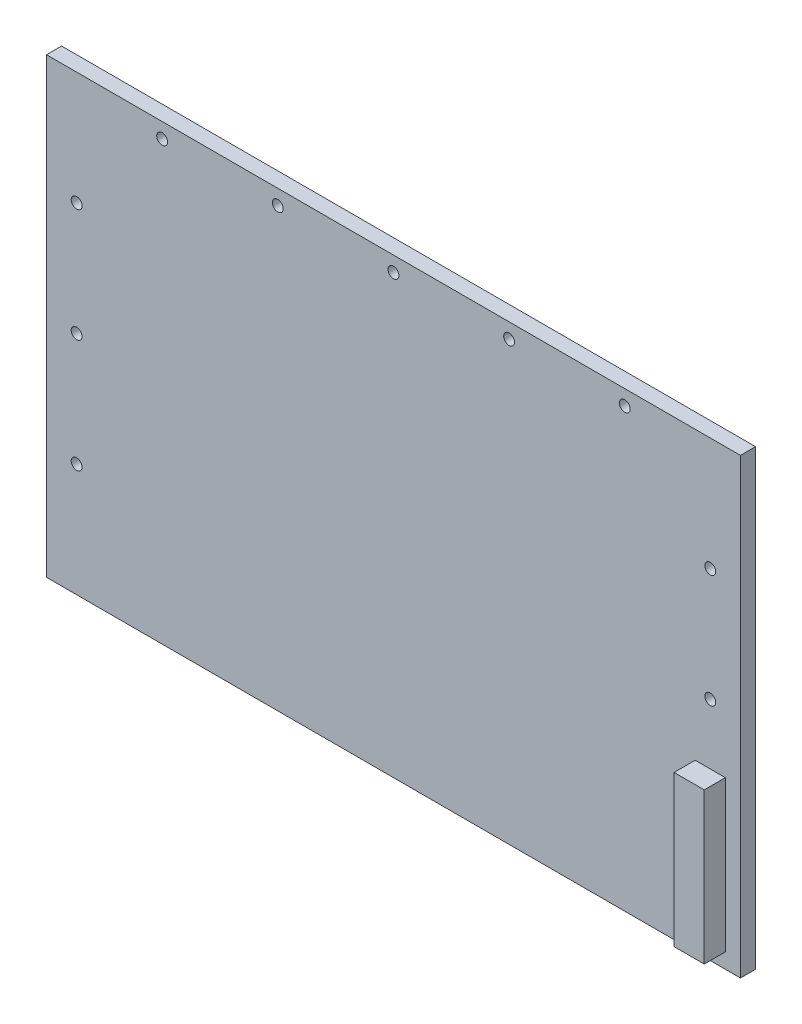
from build123d import *

# Parameters (mm, degrees)
SZKIC1_W                                          = 230
SZKIC1_H                                          = 150
DODANIE_WYCI_GNI_CIE1_DEPTH                       = 5
POG_BIENIE_WALCOWE_POD_M3_RUB_Z_BEM_S_D           = 3.6
POG_BIENIE_WALCOWE_POD_M3_RUB_Z_BEM_S_DEPTH       = 6.7
POG_BIENIE_WALCOWE_POD_M3_RUB_Z_BEM_S_CBORE_D     = 7
POG_BIENIE_WALCOWE_POD_M3_RUB_Z_BEM_S_CBORE_DEPTH = 2.4
POG_BIENIE_WALCOWE_POD_M3_RUB_Z_BEM_S_TIP         = 1.081549114
POG_BIENIE_WALCOWE_POD_M3_RUB_Z_B_2_D             = 3.6
POG_BIENIE_WALCOWE_POD_M3_RUB_Z_B_2_DEPTH         = 6.7
POG_BIENIE_WALCOWE_POD_M3_RUB_Z_B_2_CBORE_D       = 7
POG_BIENIE_WALCOWE_POD_M3_RUB_Z_B_2_CBORE_DEPTH   = 2.4
POG_BIENIE_WALCOWE_POD_M3_RUB_Z_B_2_TIP           = 1.081549114
SZKIC7_W                                          = 10
SZKIC7_H                                          = 50
DODANIE_WYCI_GNI_CIE3_DEPTH                       = 7
OTWORY_USTALAJ_CE_4_0MM1_D                        = 4
OTWORY_USTALAJ_CE_4_0MM1_DEPTH                    = 6.7


with BuildPart() as part:
    # Szkic1 → Dodanie-wyciągnięcie1 (new body)
    with BuildSketch(Plane.XY):
        Rectangle(SZKIC1_W, SZKIC1_H)
    extrude(amount=DODANIE_WYCI_GNI_CIE1_DEPTH)

    # Pog_bienie walcowe pod M3 _rub_ z _bem s
    with Locations(Plane(origin=(0, 0, 0), x_dir=(-1, 0, 0), z_dir=(0, 0, -1))):
        with Locations((105, 37.5), (105, 0), (105, -37.5), (-105, 0), (-105, 37.5)):
            CounterBoreHole(POG_BIENIE_WALCOWE_POD_M3_RUB_Z_BEM_S_D / 2, POG_BIENIE_WALCOWE_POD_M3_RUB_Z_BEM_S_CBORE_D / 2, POG_BIENIE_WALCOWE_POD_M3_RUB_Z_BEM_S_CBORE_DEPTH, depth=POG_BIENIE_WALCOWE_POD_M3_RUB_Z_BEM_S_DEPTH)
            with Locations((0, 0, -(POG_BIENIE_WALCOWE_POD_M3_RUB_Z_BEM_S_DEPTH + POG_BIENIE_WALCOWE_POD_M3_RUB_Z_BEM_S_TIP / 2))):  # 118° drill point
                Cone(0, POG_BIENIE_WALCOWE_POD_M3_RUB_Z_BEM_S_D / 2, POG_BIENIE_WALCOWE_POD_M3_RUB_Z_BEM_S_TIP, mode=Mode.SUBTRACT)

    # Pog_bienie walcowe pod M3 _rub_ z _b 2
    with Locations(Plane(origin=(0, 0, 0), x_dir=(-1, 0, 0), z_dir=(0, 0, -1))):
        with Locations((-76.666666667, 70), (-38.333333337, 70), (-7e-09, 70), (38.333333323, 70), (76.666666653, 70)):
            CounterBoreHole(POG_BIENIE_WALCOWE_POD_M3_RUB_Z_B_2_D / 2, POG_BIENIE_WALCOWE_POD_M3_RUB_Z_B_2_CBORE_D / 2, POG_BIENIE_WALCOWE_POD_M3_RUB_Z_B_2_CBORE_DEPTH, depth=POG_BIENIE_WALCOWE_POD_M3_RUB_Z_B_2_DEPTH)
            with Locations((0, 0, -(POG_BIENIE_WALCOWE_POD_M3_RUB_Z_B_2_DEPTH + POG_BIENIE_WALCOWE_POD_M3_RUB_Z_B_2_TIP / 2))):  # 118° drill point
                Cone(0, POG_BIENIE_WALCOWE_POD_M3_RUB_Z_B_2_D / 2, POG_BIENIE_WALCOWE_POD_M3_RUB_Z_B_2_TIP, mode=Mode.SUBTRACT)

    # Szkic7 → Dodanie-wyciągnięcie3 (add)
    with BuildSketch(Plane.XY.offset(5)):
        with Locations((105, -45)):
            Rectangle(SZKIC7_W, SZKIC7_H)
    extrude(amount=DODANIE_WYCI_GNI_CIE3_DEPTH)

    # Otwory ustalające Ø4.0mm1
    with Locations(Plane.XZ.offset(70)):
        with Locations((105, 8.5)):
            Hole(OTWORY_USTALAJ_CE_4_0MM1_D / 2, depth=OTWORY_USTALAJ_CE_4_0MM1_DEPTH)


solid = part.part
